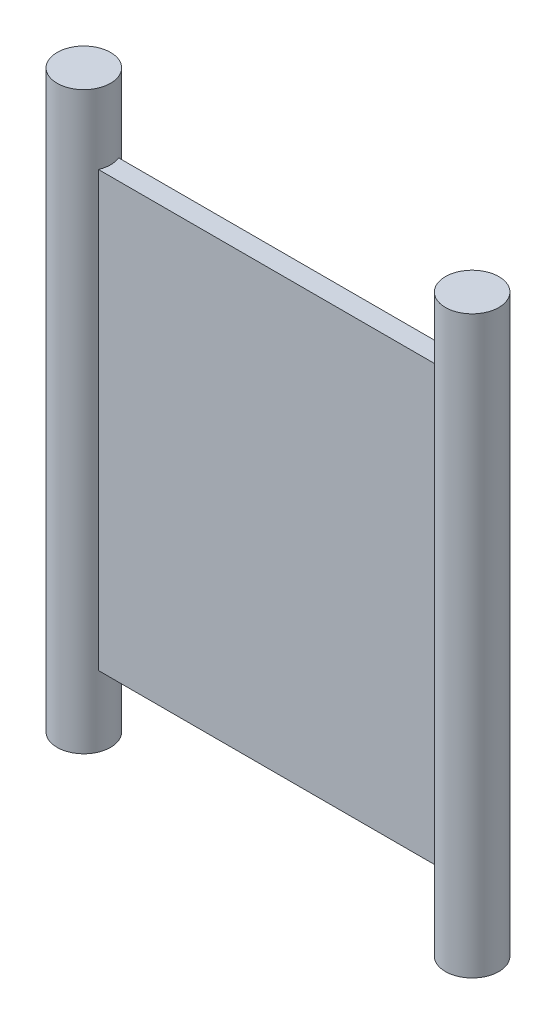
from build123d import *

# Parameters (mm, degrees)
SKETCH1_W           = 19.24
SKETCH1_H           = 1
BOSS_EXTRUDE1_DEPTH = 21.5
SKETCH2_R           = 1.325
BOSS_EXTRUDE2_DEPTH = 14.25


with BuildPart() as part:
    # Sketch1 → Boss-Extrude1 (new body)
    with BuildSketch(Plane(origin=(0, 0, 0), x_dir=(1, 0, 0), z_dir=(0, 1, 0))):
        Rectangle(SKETCH1_W, SKETCH1_H)
    extrude(amount=BOSS_EXTRUDE1_DEPTH)

    # Sketch2 → Boss-Extrude2 (add, symmetric)
    with BuildSketch(Plane(origin=(0, 10.75, 0), x_dir=(1, 0, 0), z_dir=(0, 1, 0))):
        with Locations(Location((-9.62, 0, 0), (0, 0, 270))):
            Circle(SKETCH2_R)
        with Locations(Location((9.62, 0, 0), (0, 0, 270))):
            Circle(SKETCH2_R)
    extrude(amount=BOSS_EXTRUDE2_DEPTH, both=True)


solid = part.part
